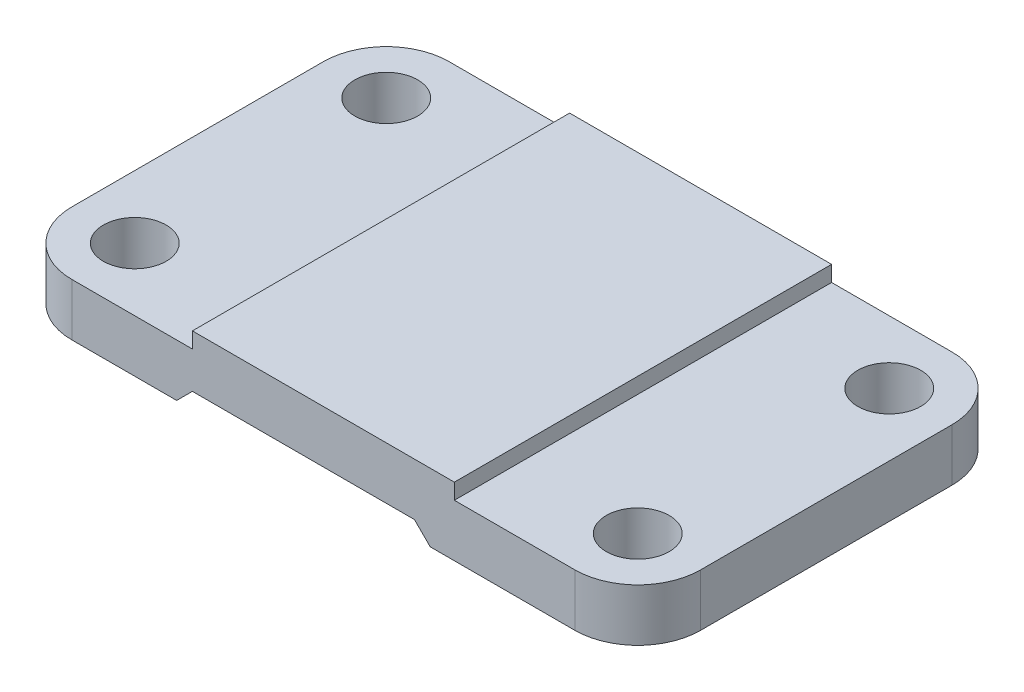
from build123d import *

# Parameters (mm, degrees)
SKETCH1_W           = 120
SKETCH1_H           = 72
BOSS_EXTRUDE1_DEPTH = 10
SKETCH2_R           = 6
CUT_EXTRUDE1_DEPTH  = 71.682388188
FILLET1_R           = 12
CUT_EXTRUDE2_DEPTH  = 95.254973344
SKETCH4_W           = 50
SKETCH4_H           = 72
BOSS_EXTRUDE3_DEPTH = 3


with BuildPart() as part:
    # Sketch1 → Boss-Extrude1 (new body)
    with BuildSketch(Plane(origin=(0, 0, 0), x_dir=(1, 0, 0), z_dir=(0, 1, 0))):
        Rectangle(SKETCH1_W, SKETCH1_H)
    extrude(amount=BOSS_EXTRUDE1_DEPTH)

    # Sketch2 → Cut-Extrude1 (cut, through all)
    with BuildSketch(Plane(origin=(0, 10, 0), x_dir=(1, 0, 0), z_dir=(0, 1, 0))):
        with Locations(Location((-48, 24, 0), (0, 0, 270))):
            Circle(SKETCH2_R)
        with Locations(Location((-48, -24, 0), (0, 0, 270))):
            Circle(SKETCH2_R)
        with Locations(Location((48, -24, 0), (0, 0, 270))):
            Circle(SKETCH2_R)
        with Locations(Location((48, 24, 0), (0, 0, 270))):
            Circle(SKETCH2_R)
    extrude(amount=-CUT_EXTRUDE1_DEPTH, mode=Mode.SUBTRACT)

    # Fillet1
    fillet1_edges = [part.edges().sort_by_distance(p)[0] for p in [
        (60, 5, 36),
        (-60, 5, 36),
        (-60, 5, -36),
        (60, 5, -36),
    ]]
    fillet(fillet1_edges, radius=FILLET1_R)

    # Sketch3 → Cut-Extrude2 (cut, through all)
    with BuildSketch(Plane.XY.offset(36)):
        Polygon((-28, 0), (-25, 3), (17.388701421, 3), (20.388701421, 0), align=None)
    extrude(amount=-CUT_EXTRUDE2_DEPTH, mode=Mode.SUBTRACT)

    # Sketch4 → Boss-Extrude3 (add)
    with BuildSketch(Plane(origin=(0, 10, 0), x_dir=(1, 0, 0), z_dir=(0, 1, 0))):
        Rectangle(SKETCH4_W, SKETCH4_H)
    extrude(amount=BOSS_EXTRUDE3_DEPTH)


solid = part.part
